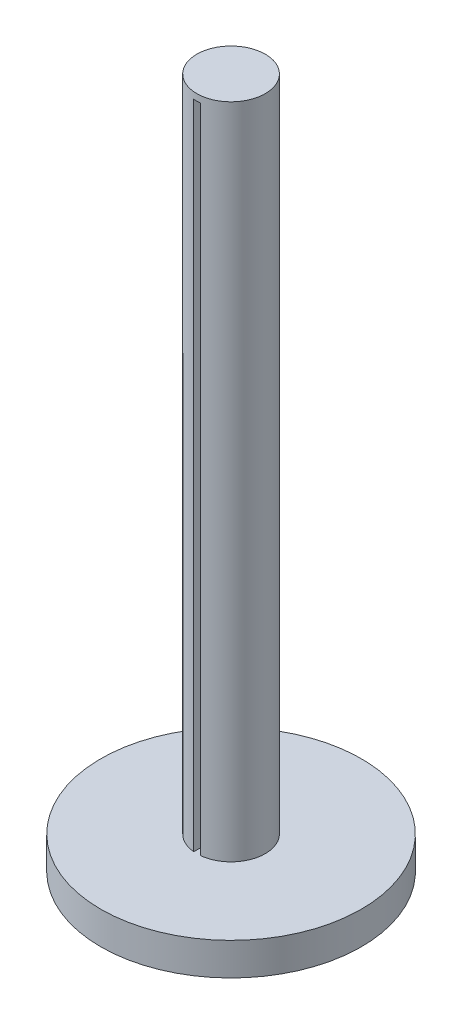
from build123d import *

# Parameters (mm, degrees)
ESQUISSE2_R                  = 52.5
CYLINDRE_DEPTH               = 1000
FENTE_DEPTH                  = 1003.752461977
ESQUISSE4_R                  = 200
SOCLE_DEPTH                  = 50
CORPS_D_PLACER_COPIER1_ANGLE = 180
BOSS_EXTRU_4_START           = 10
ESQUISSE5_R                  = 52.5
BOSS_EXTRU_4_DEPTH           = 10


with BuildPart() as part:
    # Esquisse2 → Cylindre (new body)
    with BuildSketch(Plane(origin=(0, 0, 0), x_dir=(1, 0, 0), z_dir=(0, 1, 0))):
        with Locations(Location((0, 0, 0), (0, 0, 270))):
            Circle(ESQUISSE2_R)
    extrude(amount=CYLINDRE_DEPTH)

    # Esquisse3 → Fente (cut, through all)
    with BuildSketch(Plane(origin=(0, 1000, 0), x_dir=(1, 0, 0), z_dir=(0, 1, 0))):
        with BuildLine():
            Line((0, -52.5), (0, -30))
            ThreePointArc((0, -30), (-2.508787808, -29.894915684), (-5, -29.580398915))
            Line((-5, -29.580398915), (-5, -52.261362401))
            ThreePointArc((-5, -52.261362401), (-2.502845775, -52.440306664), (0, -52.5))
        make_face()
        with BuildLine():
            Line((5, -52.261362401), (5, -29.580398915))
            ThreePointArc((5, -29.580398915), (2.508787808, -29.894915684), (0, -30))
            Line((0, -30), (0, -52.5))
            ThreePointArc((0, -52.5), (2.502845775, -52.440306664), (5, -52.261362401))
        make_face()
    extrude(amount=-FENTE_DEPTH, mode=Mode.SUBTRACT)

    # Esquisse4 → Socle (add)
    with BuildSketch(Plane(origin=(0, 1000, 0), x_dir=(1, 0, 0), z_dir=(0, 1, 0))):
        with Locations(Location((0, 0, 0), (0, 0, 270))):
            Circle(ESQUISSE4_R)
    extrude(amount=SOCLE_DEPTH)


with BuildPart() as part_1:
    # Corps-Déplacer/Copier1: moved
    add(part.part.rotate(Axis((0, 525, 0), (0, 0, 1)), CORPS_D_PLACER_COPIER1_ANGLE))

    # Esquisse5 → Boss.-Extru.4 (add)
    with BuildSketch(Plane(origin=(0, 1050, 0), x_dir=(1, 0, 0), z_dir=(0, 1, 0)).offset(BOSS_EXTRU_4_START)):
        with Locations(Location((0, 0, 0), (0, 0, 180))):
            Circle(ESQUISSE5_R)
    extrude(amount=-BOSS_EXTRU_4_DEPTH)


solid = part_1.part
